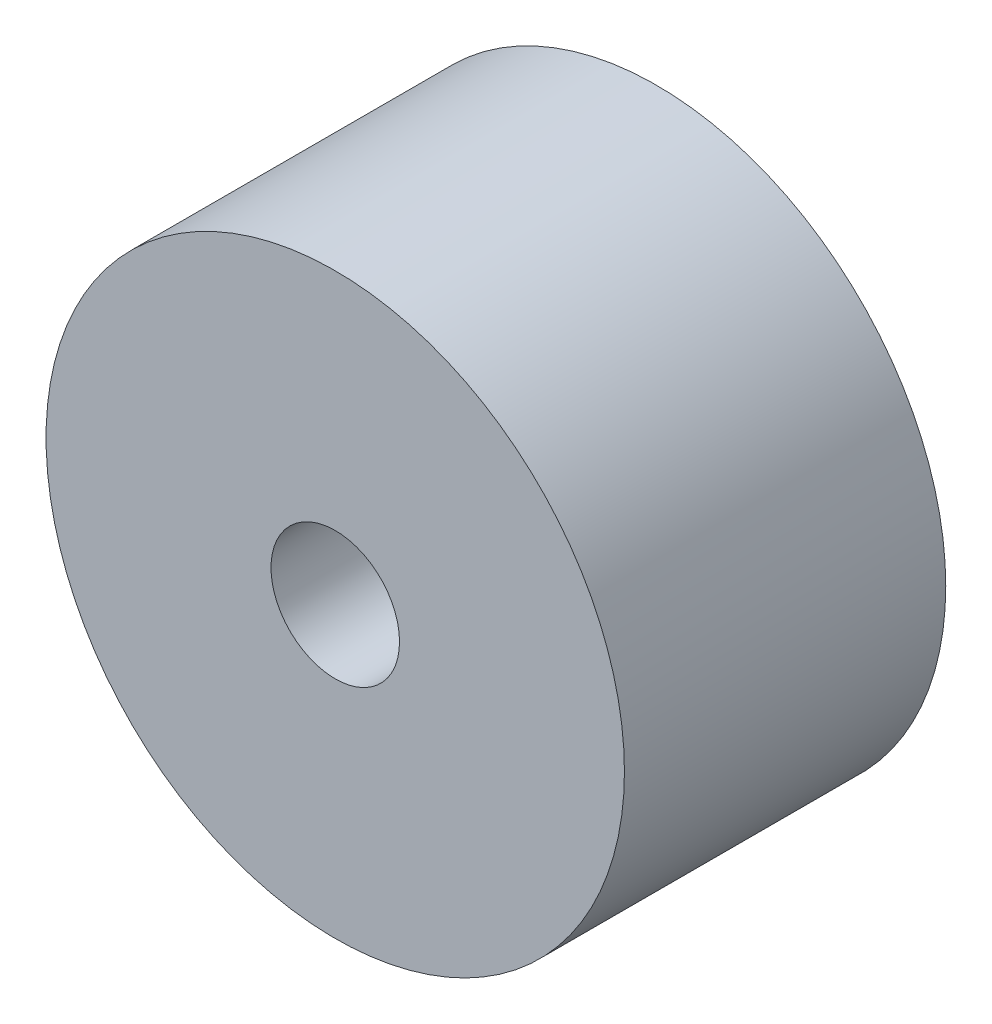
from build123d import *

# Parameters (mm, degrees)
SKETCH1_R           = 18
BOSS_EXTRUDE1_DEPTH = 20
SKETCH2_R           = 4
CUT_EXTRUDE1_DEPTH  = 20


with BuildPart() as part:
    # Sketch1 → Boss-Extrude1 (new body)
    with BuildSketch(Plane.XY):
        Circle(SKETCH1_R)
    extrude(amount=BOSS_EXTRUDE1_DEPTH)

    # Sketch2 → Cut-Extrude1 (cut)
    with BuildSketch(Plane.XY):
        Circle(SKETCH2_R)
    extrude(amount=CUT_EXTRUDE1_DEPTH, mode=Mode.SUBTRACT)


solid = part.part
